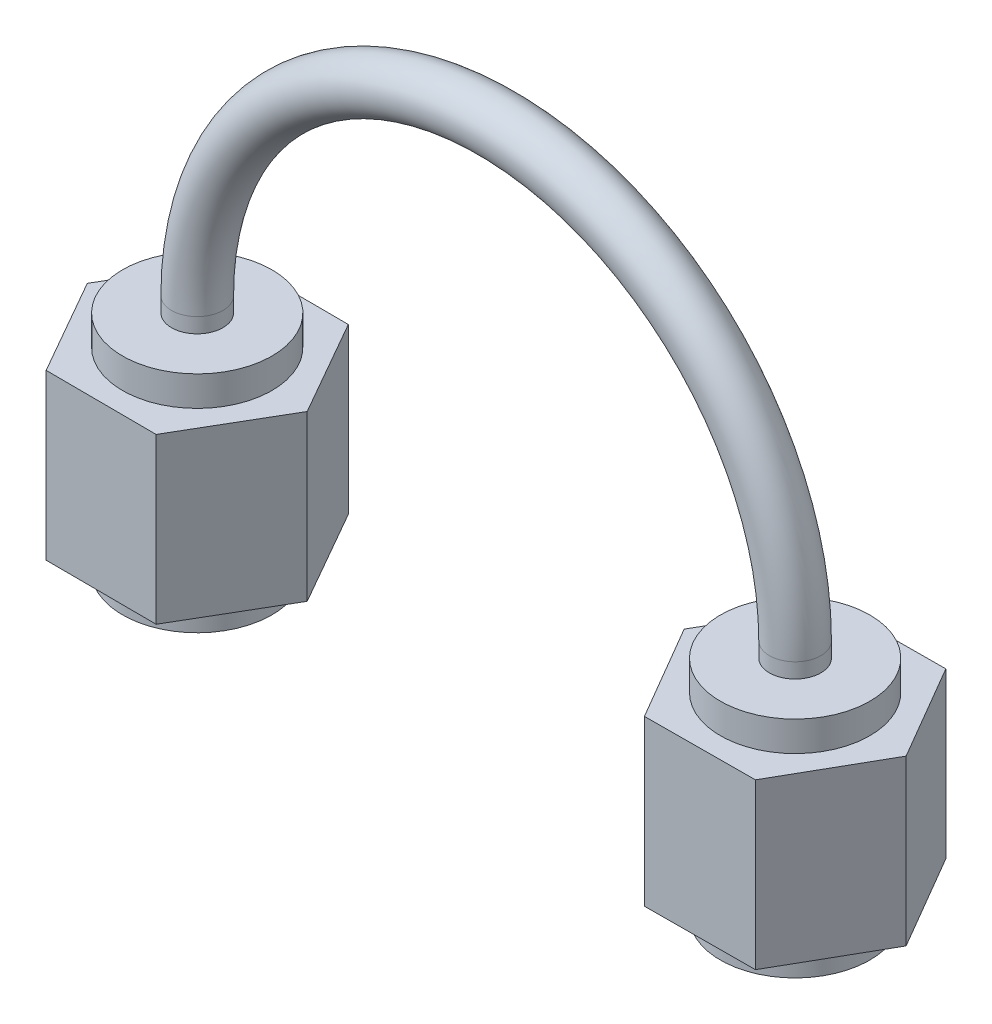
from build123d import *

# Parameters (mm, degrees)
SKETCH1_R             = 3.175
BOSS_EXTRUDE1_DEPTH   = 9.525
BOSS_EXTRUDE1_2_DEPTH = 9.525
BOSS_EXTRUDE2_START   = -1.27
BOSS_EXTRUDE2_DEPTH   = 6.985
SKETCH4_R             = 1.0922


with BuildPart() as part:
    # Sketch1 → Boss-Extrude1 (new body)
    with BuildSketch(Plane(origin=(0, 0, 0), x_dir=(1, 0, 0), z_dir=(0, 1, 0))):
        with Locations(Location((-12.7, 0, 0), (0, 0, 90))):
            Circle(SKETCH1_R)
    extrude(amount=BOSS_EXTRUDE1_DEPTH)

    # Sketch2 → Boss-Extrude2 (add)
    with BuildSketch(Plane(origin=(0, 9.525, 0), x_dir=(1, 0, 0), z_dir=(0, 1, 0)).offset(BOSS_EXTRUDE2_START)):
        Polygon((-8.007347217, -0.021706912), (-10.334874871, 4.053103065), (-15.027527654, 4.074809978), (-17.392652783, 0.021706912), (-15.065125129, -4.053103065), (-10.372472346, -4.074809978), align=None)
    boss_extrude2 = extrude(amount=-BOSS_EXTRUDE2_DEPTH)



with BuildPart() as body_2:
    # Sketch1 → Boss-Extrude1 2 (new body)
    with BuildSketch(Plane(origin=(0, 0, 0), x_dir=(1, 0, 0), z_dir=(0, 1, 0))):
        with Locations(Location((12.7, 0, 0), (0, 0, 90))):
            Circle(SKETCH1_R)
    extrude(amount=BOSS_EXTRUDE1_2_DEPTH)

    # Mirror1: Boss-Extrude2 across plane
    add(boss_extrude2.mirror(Plane(origin=(0, 0, 0), x_dir=(0, 0, 1), z_dir=(1, 0, 0))))


with BuildPart() as part_1:
    add(part.part)

    add(body_2.part)  # Sweep1 merges body 2
    # Sweep1: sweep along a path in Sketch3
    with BuildLine(Plane.XY) as sweep1_path:
        Line((-12.7, 9.525), (-12.7, 10.16))
        ThreePointArc((-12.7, 10.16), (0, 22.86), (12.7, 10.16))
        Line((12.7, 10.16), (12.7, 9.525))
    # Sketch4 → Sweep1 (sweep)
    with BuildSketch(Plane(origin=(0, 9.525, 0), x_dir=(1, 0, 0), z_dir=(0, 1, 0))):
        with Locations((-12.7, 0)):
            Circle(SKETCH4_R)
    sweep(path=sweep1_path.line)


solid = part_1.part
